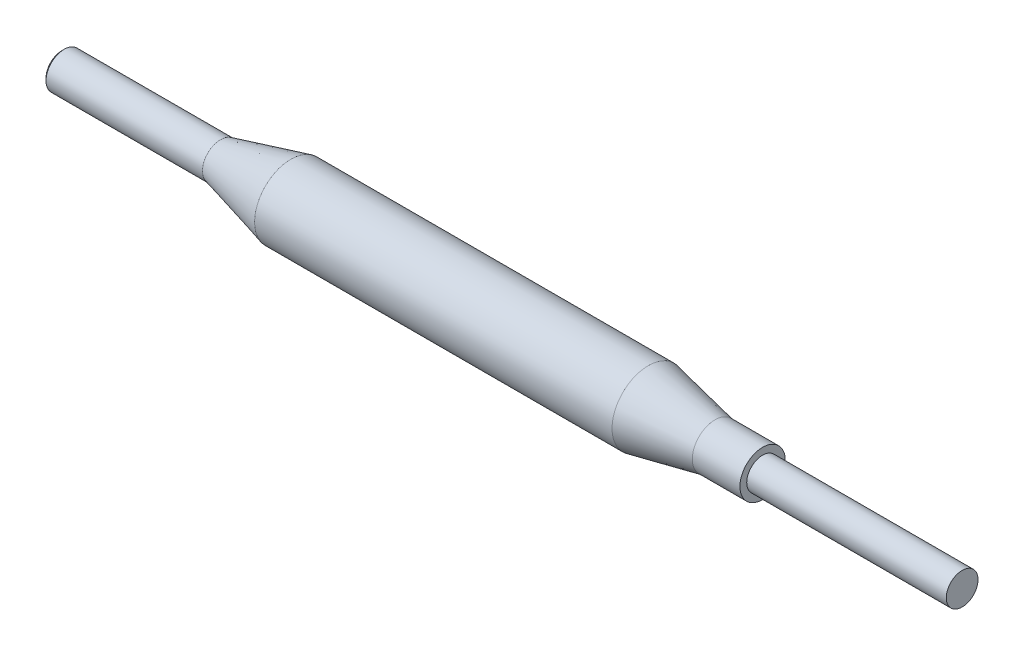
from build123d import *

# Parameters (mm, degrees)
PAH1_SIZE = 0.5


with BuildPart() as part:
    # Çizim1 → Döndür1 (revolve)
    with BuildSketch(Plane.XY, mode=Mode.PRIVATE) as d_nd_r1_sk:
        Polygon((0, 0), (0, 4), (35, 4), (50.491933385, 8), (129.303061543, 8), (144, 5), (154.5, 5), (154.5, 3.5), (198.5, 3.5), (198.5, 0), align=None)
    revolve(d_nd_r1_sk.sketch.rotate(Axis((0, 0, 0), (1, 0, 0)), 90), axis=Axis((0, 0, 0), (1, 0, 0)))

    # Pah1
    pah1_edges = [part.edges().sort_by_distance(p)[0] for p in [
        (0, 0, -4),
    ]]
    chamfer(pah1_edges, length=PAH1_SIZE)


solid = part.part
